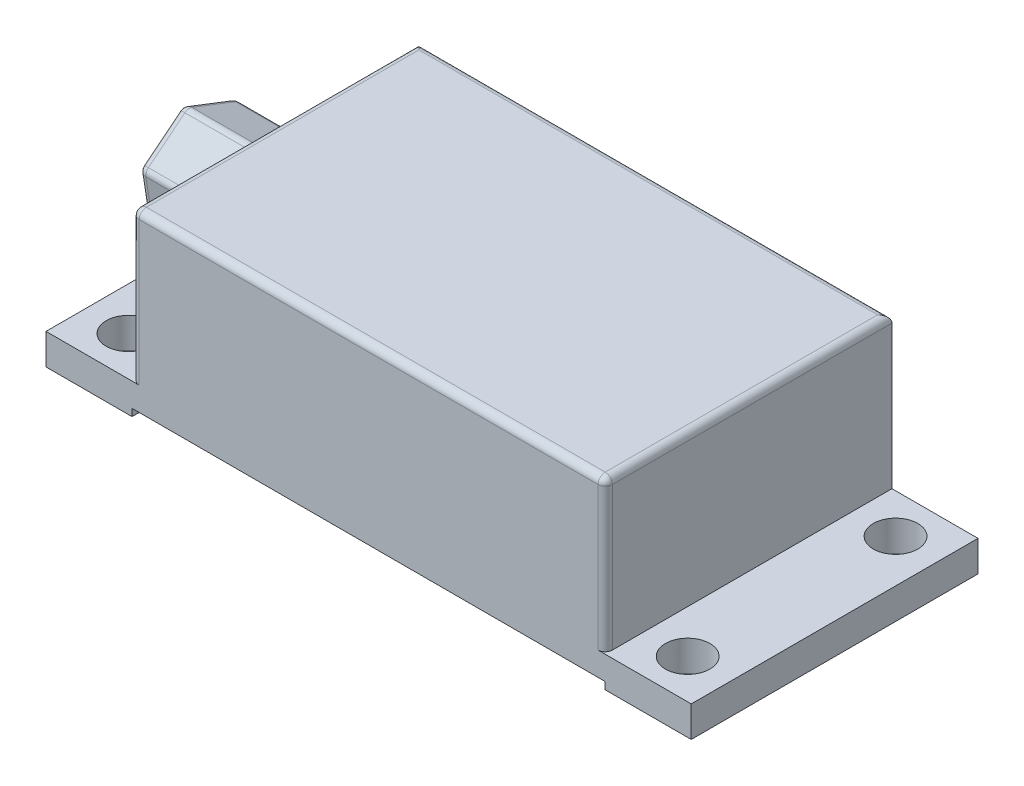
from build123d import *

# Parameters (mm, degrees)
SKETCH_13_W         = 90
SKETCH_13_H         = 40
EXTRUDE_8_DEPTH     = 25.3
SKETCH_15_W         = 66
SKETCH_15_H         = 40
CUT_EXTRUDE_3_DEPTH = 1
SKETCH_17_W         = 12
SKETCH_17_H         = 21
CUT_EXTRUDE_4_DEPTH = 40
EXTRUDE_10_DEPTH    = 12
FILLET_1_R          = 1
FILLET_2_R          = 1
FILLET_3_R          = 1
CUT_EXTRUDE_5_REACH = 65.765
SKETCH_22_R         = 3.1


with BuildPart() as part:
    # 草图13 → 凸台-拉伸8 (new body)
    with BuildSketch(Plane(origin=(0, 0, 0), x_dir=(1, 0, 0), z_dir=(0, 1, 0))):
        with Locations((0, 20)):
            Rectangle(SKETCH_13_W, SKETCH_13_H)
    extrude(amount=EXTRUDE_8_DEPTH)

    # 草图15 → 切除-拉伸3 (cut)
    with BuildSketch(Plane.XZ):
        with Locations((0, -20)):
            Rectangle(SKETCH_15_W, SKETCH_15_H)
    extrude(amount=-CUT_EXTRUDE_3_DEPTH, mode=Mode.SUBTRACT)

    # 草图17 → 切除-拉伸4 (cut)
    with BuildSketch(Plane.XY):
        with Locations((-39, 14.8)):
            Rectangle(SKETCH_17_W, SKETCH_17_H)
        with Locations((39, 14.8)):
            Rectangle(SKETCH_17_W, SKETCH_17_H)
    extrude(amount=-CUT_EXTRUDE_4_DEPTH, mode=Mode.SUBTRACT)

    # 草图19 → 凸台-拉伸10 (add)
    with BuildSketch(Plane.ZY.offset(33)):
        Polygon((-13.58148117, 18.169722386), (-20, 14.8), (-13.778047619, 11.533475), (-12.839009712, 17.571921973), align=None)
        Polygon((-25.98104999, 19.61563852), (-26.221952381, 18.066525), (-20, 14.8), (-13.58148117, 18.169722386), (-18.820059701, 22.387560492), align=None)
        Polygon((-20, 14.8), (-26.221952381, 18.066525), (-27.160990288, 12.028078027), (-26.41851883, 11.430277614), align=None)
        Polygon((-13.778047619, 11.533475), (-20, 14.8), (-26.41851883, 11.430277614), (-21.179940299, 7.212439508), (-14.01895001, 9.98436148), align=None)
    extrude(amount=EXTRUDE_10_DEPTH)

    # 圆角1
    fillet_1_edges = [part.edges().sort_by_distance(p)[0] for p in [
        (0, 25.3, 0),
    ]]
    fillet(fillet_1_edges, radius=FILLET_1_R)

    # 圆角2
    fillet_2_edges = [part.edges().sort_by_distance(p)[0] for p in [
        (0, 25.3, -40),
        (-33, 25.3, -20.5),
        (-33, 14.3, 0),
        (33, 14.3, 0),
        (33, 25.3, -20.5),
        (33, 25.007106781, -0.292893219),
        (-33, 25.007106781, -0.292893219),
    ]]
    fillet(fillet_2_edges, radius=FILLET_2_R)

    # 圆角3
    fillet_3_edges = [part.edges().sort_by_distance(p)[0] for p in [
        (-45, 21.001599506, -22.400554846),
        (-39, 22.387560492, -18.820059701),
        (-45, 19.979741232, -15.829534706),
        (-39, 17.571921973, -12.839009712),
        (-45, 13.778141726, -13.428979861),
        (-39, 9.98436148, -14.01895001),
        (-45, 8.598400494, -17.599445154),
        (-39, 7.212439508, -21.179940299),
        (-45, 9.620258768, -24.170465294),
        (-39, 12.028078027, -27.160990288),
        (-45, 15.821858274, -26.571020139),
        (-39, 19.61563852, -25.98104999),
    ]]
    fillet(fillet_3_edges, radius=FILLET_3_R)

    # 草图22 → 切除-拉伸5 (cut, up to next)
    with BuildSketch(Plane(origin=(0, 4.3, 0), x_dir=(1, 0, 0), z_dir=(0, 1, 0)), mode=Mode.PRIVATE) as cut_extrude_5_sk1:
        with Locations(Location((-39, 5.5, 0), (0, 0, 270))):
            Circle(SKETCH_22_R)
    cut_extrude_5_tool1 = extrude(cut_extrude_5_sk1.sketch, amount=-CUT_EXTRUDE_5_REACH, mode=Mode.PRIVATE) & part.part
    # 草图22 → 切除-拉伸5 (cut, up to next)
    with BuildSketch(Plane(origin=(0, 4.3, 0), x_dir=(1, 0, 0), z_dir=(0, 1, 0)), mode=Mode.PRIVATE) as cut_extrude_5_sk2:
        with Locations(Location((39, 5.5, 0), (0, 0, 270))):
            Circle(SKETCH_22_R)
    cut_extrude_5_tool2 = extrude(cut_extrude_5_sk2.sketch, amount=-CUT_EXTRUDE_5_REACH, mode=Mode.PRIVATE) & part.part
    # 草图22 → 切除-拉伸5 (cut, up to next)
    with BuildSketch(Plane(origin=(0, 4.3, 0), x_dir=(1, 0, 0), z_dir=(0, 1, 0)), mode=Mode.PRIVATE) as cut_extrude_5_sk3:
        with Locations(Location((39, 34.5, 0), (0, 0, 270))):
            Circle(SKETCH_22_R)
    cut_extrude_5_tool3 = extrude(cut_extrude_5_sk3.sketch, amount=-CUT_EXTRUDE_5_REACH, mode=Mode.PRIVATE) & part.part
    # 草图22 → 切除-拉伸5 (cut, up to next)
    with BuildSketch(Plane(origin=(0, 4.3, 0), x_dir=(1, 0, 0), z_dir=(0, 1, 0)), mode=Mode.PRIVATE) as cut_extrude_5_sk4:
        with Locations(Location((-39, 34.5, 0), (0, 0, 270))):
            Circle(SKETCH_22_R)
    cut_extrude_5_tool4 = extrude(cut_extrude_5_sk4.sketch, amount=-CUT_EXTRUDE_5_REACH, mode=Mode.PRIVATE) & part.part
    add(cut_extrude_5_tool1.solids().sort_by_distance((-39, 4.3, -5.5))[0], mode=Mode.SUBTRACT)
    add(cut_extrude_5_tool2.solids().sort_by_distance((39, 4.3, -5.5))[0], mode=Mode.SUBTRACT)
    add(cut_extrude_5_tool3.solids().sort_by_distance((39, 4.3, -34.5))[0], mode=Mode.SUBTRACT)
    add(cut_extrude_5_tool4.solids().sort_by_distance((-39, 4.3, -34.5))[0], mode=Mode.SUBTRACT)


solid = part.part
